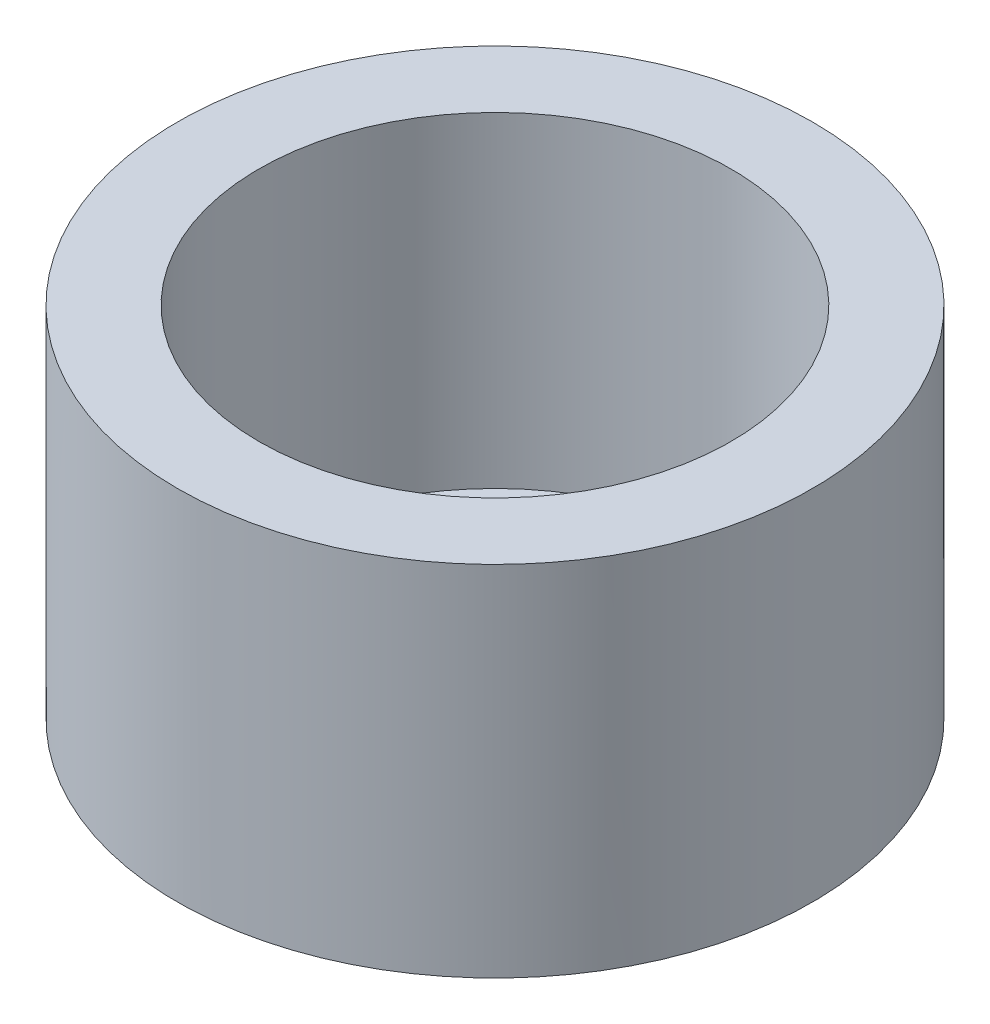
from build123d import *

# Parameters (mm, degrees)
SKETCH2_R           = 19.5
SKETCH2_R_2         = 14.5
BOSS_EXTRUDE1_DEPTH = 20
BOSS_EXTRUDE2_START = 2
SKETCH3_R           = 19.5
BOSS_EXTRUDE2_DEPTH = 2
SKETCH4_R           = 2.85
BOSS_EXTRUDE3_DEPTH = 6


with BuildPart() as part:
    # Sketch2 → Boss-Extrude1 (new body)
    with BuildSketch(Plane(origin=(0, 0, 0), x_dir=(1, 0, 0), z_dir=(0, 1, 0))):
        with Locations(Location((0, 0, 0), (0, 0, 270))):
            Circle(SKETCH2_R)
        with Locations(Location((0, 0, 0), (0, 0, 270))):
            Circle(SKETCH2_R_2, mode=Mode.SUBTRACT)
    extrude(amount=BOSS_EXTRUDE1_DEPTH)

    # Sketch3 → Boss-Extrude2 (add)
    with BuildSketch(Plane.XZ.offset(BOSS_EXTRUDE2_START)):
        with Locations(Location((0, 0, 0), (0, 0, 270))):
            Circle(SKETCH3_R)
    extrude(amount=-BOSS_EXTRUDE2_DEPTH)

    # Sketch4 → Boss-Extrude3 (add)
    with BuildSketch(Plane.XZ.offset(2)):
        with Locations(Location((0, 0, 0), (0, 0, 270))):
            Circle(SKETCH4_R)
    extrude(amount=BOSS_EXTRUDE3_DEPTH)


solid = part.part
